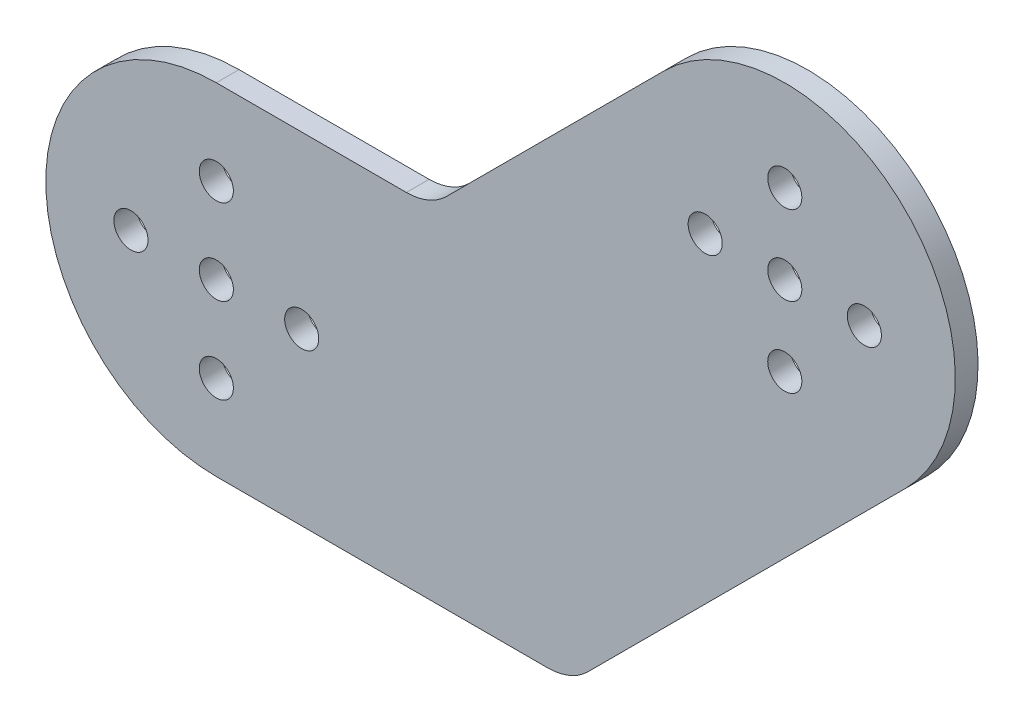
from build123d import *

# Parameters (mm, degrees)
SALIENTE_EXTRUIR1_DEPTH = 2
CROQUIS1_R              = 1.5
CORTAR_EXTRUIR1_DEPTH   = 2
CROQUIS2_R              = 1.5
CORTAR_EXTRUIR2_DEPTH   = 2
MATRIZC1_COUNT          = 4
CROQUIS4_R              = 1.5
CORTAR_EXTRUIR3_DEPTH   = 2
CROQUIS5_R              = 1.5
CORTAR_EXTRUIR4_DEPTH   = 2
MATRIZC2_COUNT          = 4


with BuildPart() as part:
    # Croquis3 → Saliente-Extruir1 (new body)
    with BuildSketch(Plane.XY):
        with BuildLine():
            Line((0, 15), (16.715728753, 15))
            ThreePointArc((16.715728753, 15), (18.629145914, 15.380602337), (20.251262658, 16.464466094))
            Line((20.251262658, 16.464466094), (39.393398282, 35.606601717))
            ThreePointArc((39.393398282, 35.606601717), (60.606601717, 35.606601717), (60.606601717, 14.393398282))
            Line((60.606601717, 14.393398282), (32.67766953, -13.535533906))
            ThreePointArc((32.67766953, -13.535533906), (31.055552786, -14.619397663), (29.142135624, -15))
            Line((29.142135624, -15), (0, -15))
            ThreePointArc((0, -15), (-15, 0), (0, 15))
        make_face()
    extrude(amount=SALIENTE_EXTRUIR1_DEPTH)

    # Croquis1 → Cortar-Extruir1 (cut)
    with BuildSketch(Plane.XY):
        Circle(CROQUIS1_R)
    extrude(amount=CORTAR_EXTRUIR1_DEPTH, mode=Mode.SUBTRACT)

    # Croquis2 → Cortar-Extruir2 (cut)
    with BuildSketch(Plane.XY):
        with Locations((0, 7.509798768)):
            Circle(CROQUIS2_R)
    cortar_extruir2 = extrude(amount=CORTAR_EXTRUIR2_DEPTH, mode=Mode.SUBTRACT)

    # MatrizC1: Cortar-Extruir2 ×4 about axis
    matrizc1_axis = Axis((0, 0, 0), (0, 0, 1))
    for i in range(1, MATRIZC1_COUNT):
        add(cortar_extruir2.rotate(matrizc1_axis, i * 360 / MATRIZC1_COUNT), mode=Mode.SUBTRACT)

    # Croquis4 → Cortar-Extruir3 (cut)
    with BuildSketch(Plane.XY.offset(2)):
        with Locations((50, 25)):
            Circle(CROQUIS4_R)
    extrude(amount=-CORTAR_EXTRUIR3_DEPTH, mode=Mode.SUBTRACT)

    # Croquis5 → Cortar-Extruir4 (cut)
    with BuildSketch(Plane.XY.offset(2)):
        with Locations((50, 32)):
            Circle(CROQUIS5_R)
    cortar_extruir4 = extrude(amount=-CORTAR_EXTRUIR4_DEPTH, mode=Mode.SUBTRACT)

    # MatrizC2: Cortar-Extruir4 ×4 about axis
    matrizc2_axis = Axis((50, 25, 0), (0, 0, 1))
    for i in range(1, MATRIZC2_COUNT):
        add(cortar_extruir4.rotate(matrizc2_axis, i * 360 / MATRIZC2_COUNT), mode=Mode.SUBTRACT)


solid = part.part
